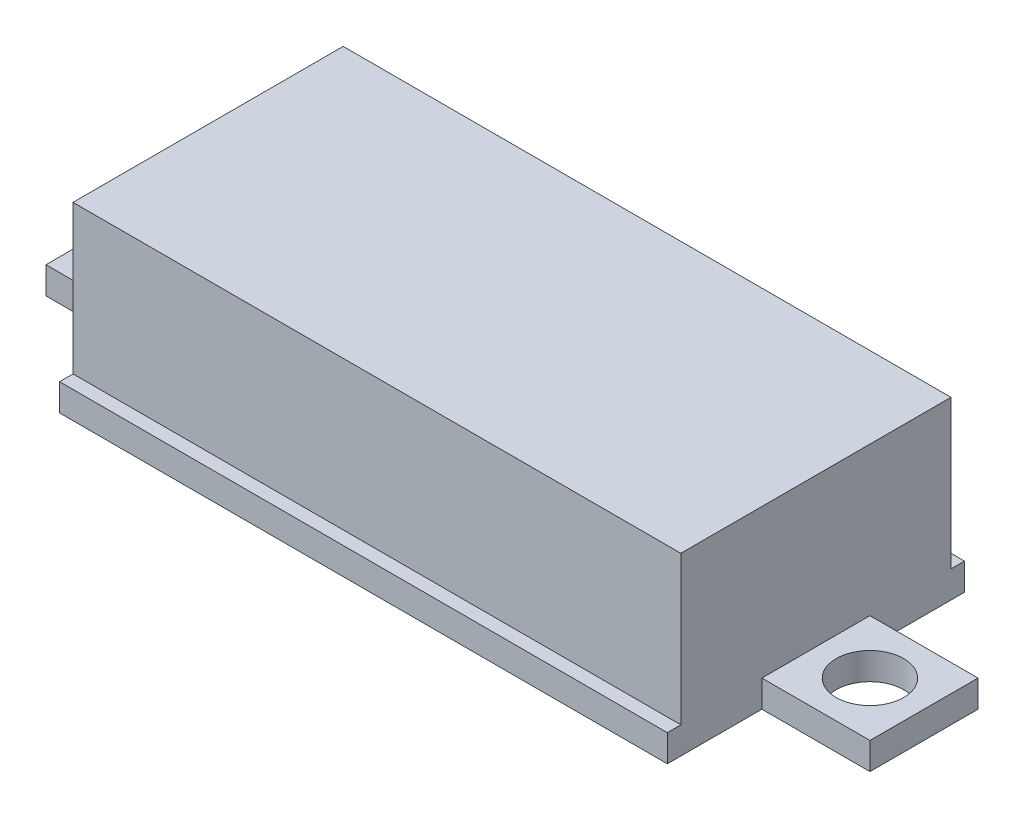
from build123d import *

# Parameters (mm, degrees)
SKETCH_1_W      = 22.5
SKETCH_1_H      = 11
SKETCH_1_W_2    = 4
SKETCH_1_H_2    = 4
SKETCH_1_R      = 1.25
EXTRUDE_1_DEPTH = 1
SKETCH_2_W      = 22.5
SKETCH_2_H      = 10
EXTRUDE_2_DEPTH = 5.5


with BuildPart() as part:
    # Эскиз1 → Бобышка-Вытянуть1 (new body)
    # profile 1 of 3: a face of its own
    with BuildSketch(Plane(origin=(0, 0, 0), x_dir=(1, 0, 0), z_dir=(0, 1, 0))):
        Rectangle(SKETCH_1_W, SKETCH_1_H)
    # profile 2 of 3: a face of its own
    with BuildSketch(Plane(origin=(0, 0, 0), x_dir=(1, 0, 0), z_dir=(0, 1, 0))):
        with Locations((-13.25, 0)):
            Rectangle(SKETCH_1_W_2, SKETCH_1_H_2)
        with Locations(Location((-13.25, 0, 0), (0, 0, 270))):
            Circle(SKETCH_1_R, mode=Mode.SUBTRACT)
    # profile 3 of 3: a face of its own
    with BuildSketch(Plane(origin=(0, 0, 0), x_dir=(1, 0, 0), z_dir=(0, 1, 0))):
        with Locations((13.25, 0)):
            Rectangle(SKETCH_1_W_2, SKETCH_1_H_2)
        with Locations(Location((13.25, 0, 0), (0, 0, 270))):
            Circle(SKETCH_1_R, mode=Mode.SUBTRACT)
    extrude(amount=EXTRUDE_1_DEPTH)

    # Эскиз2 → Бобышка-Вытянуть2 (add)
    with BuildSketch(Plane(origin=(0, 1, 0), x_dir=(1, 0, 0), z_dir=(0, 1, 0))):
        Rectangle(SKETCH_2_W, SKETCH_2_H)
    extrude(amount=EXTRUDE_2_DEPTH)


solid = part.part
